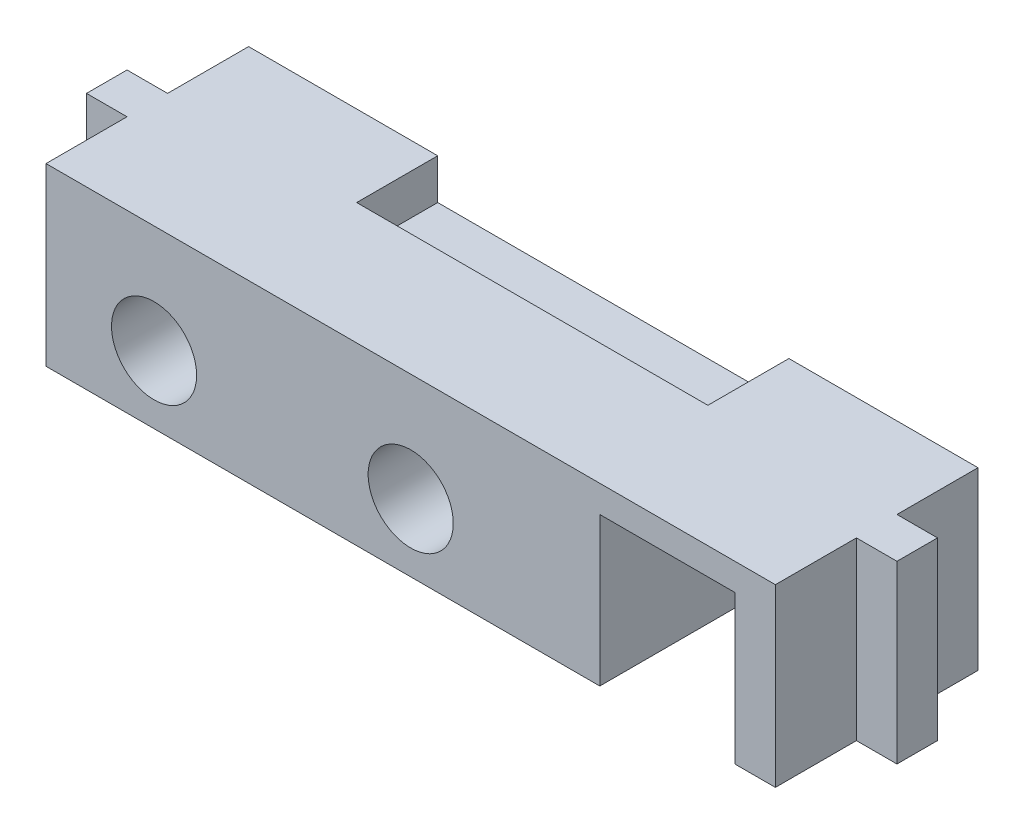
from build123d import *

# Parameters (mm, degrees)
SKETCH1_R           = 3.15
BOSS_EXTRUDE1_DEPTH = 7.5
SKETCH2_W           = 4
SKETCH2_H           = 4
BOSS_EXTRUDE2_DEPTH = 2.5
CUT_EXTRUDE1_START  = -7.5
SKETCH3_W           = 3
SKETCH3_H           = 13
CUT_EXTRUDE1_DEPTH  = 6
SKETCH4_W           = 3
SKETCH4_H           = 13
CUT_EXTRUDE2_DEPTH  = 6
SKETCH5_W           = 26
SKETCH5_H           = 3
CUT_EXTRUDE3_DEPTH  = 6
BOSS_EXTRUDE3_DEPTH = 5.9


with BuildPart() as part:
    # Sketch1 → Boss-Extrude1 (new, symmetric)
    with BuildSketch(Plane.XY):
        Polygon((-30, -5), (-30, 8), (30, 8), (30, -5), (24, -5), (24, 6), (14, 6), (14, -5), align=None)
        with Locations((-19, 0)):
            Circle(SKETCH1_R, mode=Mode.SUBTRACT)
        Circle(SKETCH1_R, mode=Mode.SUBTRACT)
    extrude(amount=BOSS_EXTRUDE1_DEPTH, both=True)

    # Sketch2 → Boss-Extrude2 (add)
    with BuildSketch(Plane.XZ.offset(5)):
        with Locations((8, 0)):
            Rectangle(SKETCH2_W, SKETCH2_H)
        with Locations((-8, 0)):
            Rectangle(SKETCH2_W, SKETCH2_H)
    extrude(amount=BOSS_EXTRUDE2_DEPTH)

    # Sketch3 → Cut-Extrude1 (cut)
    with BuildSketch(Plane.XY.offset(CUT_EXTRUDE1_START)):
        with Locations((-28.5, 1.5)):
            Rectangle(SKETCH3_W, SKETCH3_H)
        with Locations((28.5, 1.5)):
            Rectangle(SKETCH3_W, SKETCH3_H)
    extrude(amount=CUT_EXTRUDE1_DEPTH, mode=Mode.SUBTRACT)

    # Sketch4 → Cut-Extrude2 (cut)
    with BuildSketch(Plane.XY.offset(7.5)):
        with Locations((28.5, 1.5)):
            Rectangle(SKETCH4_W, SKETCH4_H)
        with Locations((-28.5, 1.5)):
            Rectangle(SKETCH4_W, SKETCH4_H)
    extrude(amount=-CUT_EXTRUDE2_DEPTH, mode=Mode.SUBTRACT)

    # Sketch5 → Cut-Extrude3 (cut)
    with BuildSketch(Plane(origin=(0, 0, -7.5), x_dir=(-1, 0, 0), z_dir=(0, 0, -1))):
        with Locations((0, 6.5)):
            Rectangle(SKETCH5_W, SKETCH5_H)
    extrude(amount=-CUT_EXTRUDE3_DEPTH, mode=Mode.SUBTRACT)

    # Sketch6 → Boss-Extrude3 (add)
    with BuildSketch(Plane(origin=(0, 0, -7.5), x_dir=(-1, 0, 0), z_dir=(0, 0, -1))):
        with BuildLine():
            Line((-14, 6), (-17.9, 6))
            ThreePointArc((-17.9, 6), (-15.702704612, 5.132040834), (-14, 3.494281042))
            Line((-14, 3.494281042), (-14, 6))
        make_face()
        with BuildLine():
            Line((-24, 6), (-24, 3.494281042))
            ThreePointArc((-24, 3.494281042), (-22.297295388, 5.132040834), (-20.1, 6))
            Line((-20.1, 6), (-24, 6))
        make_face()
    extrude(amount=-BOSS_EXTRUDE3_DEPTH)


solid = part.part
